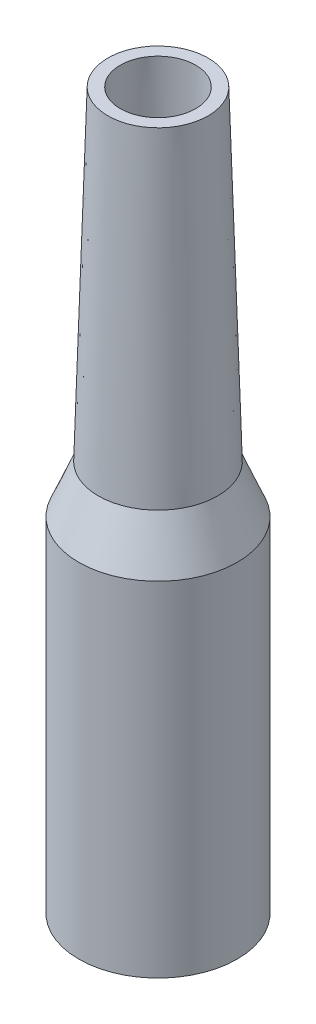
from build123d import *


with BuildPart() as part:
    # Sketch2 → Revolve1 (revolve)
    with BuildSketch(Plane.XY):
        Polygon((6.25, 0), (5.25, 33.985290936), (3.95, 33.985290936), (4.95, 0), (7, -5), (7, -41), (8.3, -41), (8.3, -5), align=None)
    revolve(axis=Axis((0, -1000, 0), (0, 1, 0)))


solid = part.part
